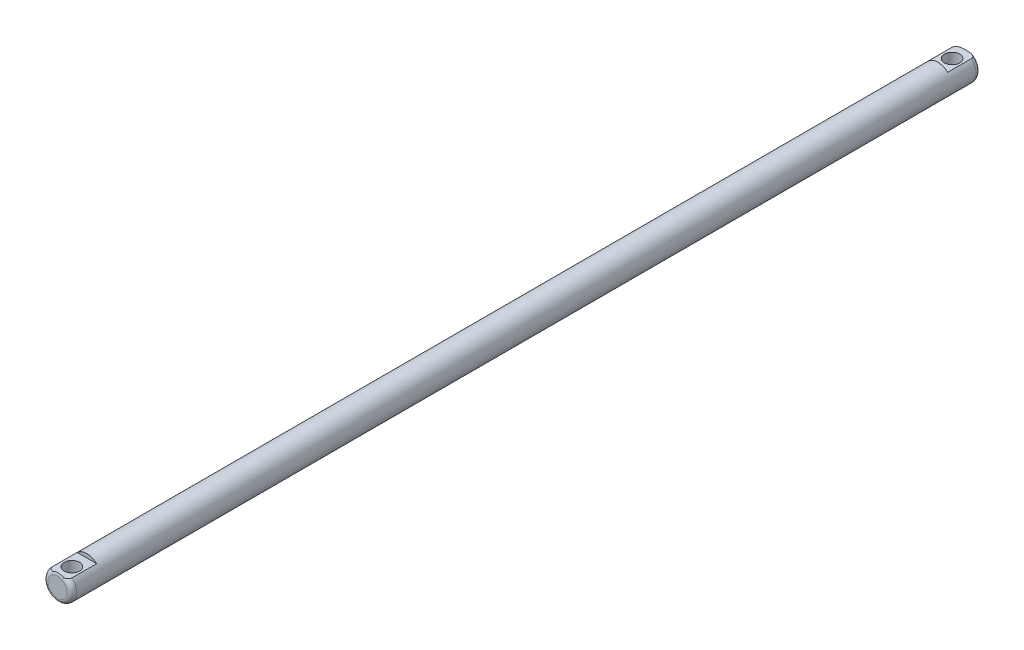
from build123d import *

# Parameters (mm, degrees)
SKETCH1_R               = 1.5
BOSS_EXTRUDE1_DEPTH     = 95
CUT_EXTRUDE1_DEPTH      = 50
CUT_EXTRUDE1_DEPTH_BACK = 50
SKETCH3_R               = 0.8
FILLET1_R               = 0.5
SKETCH4_W               = 2.5
SKETCH4_H               = 3
CUT_EXTRUDE3_DEPTH      = 0.4


with BuildPart() as part:
    # Sketch1 → Boss-Extrude1 (new body)
    with BuildSketch(Plane.XY):
        with Locations((-5.911296371, 0)):
            Circle(SKETCH1_R)
    extrude(amount=BOSS_EXTRUDE1_DEPTH)

    # Sketch3 → Cut-Extrude1 (cut, two sides: drawn at the far end of the back side and taken through both)
    with BuildSketch(Plane(origin=(0, 0, 0), x_dir=(1, 0, 0), z_dir=(0, 1, 0)).offset(-CUT_EXTRUDE1_DEPTH_BACK)):
        with Locations((-5.911296371, -1.5)):
            Circle(SKETCH3_R)
        with Locations((-5.911296371, -93.5)):
            Circle(SKETCH3_R)
    extrude(amount=CUT_EXTRUDE1_DEPTH + CUT_EXTRUDE1_DEPTH_BACK, mode=Mode.SUBTRACT)

    # Fillet1
    fillet1_edges = [part.edges().sort_by_distance(p)[0] for p in [
        (-7.411296371, 0, 0),
        (-7.411296371, 0, 95),
    ]]
    fillet(fillet1_edges, radius=FILLET1_R)

    # Sketch4 → Cut-Extrude3 (cut)
    with BuildSketch(Plane(origin=(0, 1.5, 0), x_dir=(1, 0, 0), z_dir=(0, 1, 0))):
        with Locations((-5.911296371, -93.433012702)):
            Rectangle(SKETCH4_W, SKETCH4_H)
        with Locations((-5.911296371, -1.484191421)):
            Rectangle(SKETCH4_W, SKETCH4_H)
    extrude(amount=-CUT_EXTRUDE3_DEPTH, mode=Mode.SUBTRACT)


solid = part.part
